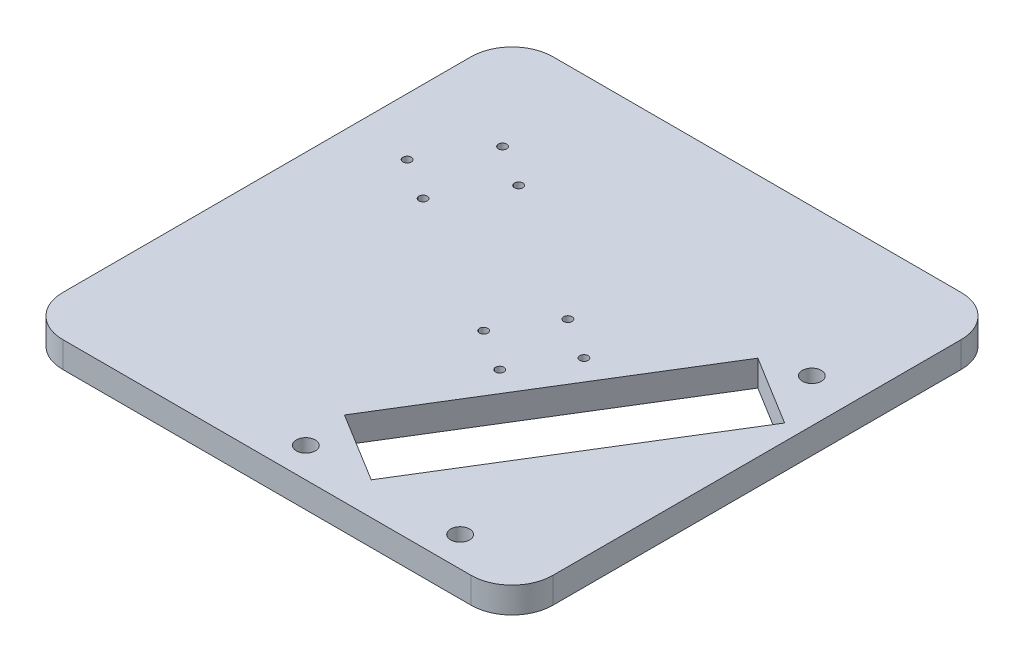
from build123d import *

# Parameters (mm, degrees)
BOSS_EXTRUDE1_DEPTH = 6.35
SKETCH2_R           = 2.325
CUT_EXTRUDE1_DEPTH  = 170.824387236
SKETCH5_R           = 1.025
CUT_EXTRUDE2_DEPTH  = 170.824387236


with BuildPart() as part:
    # Sketch1 → Boss-Extrude1 (new body)
    with BuildSketch(Plane(origin=(0, 0, 0), x_dir=(1, 0, 0), z_dir=(0, 1, 0))):
        with BuildLine():
            Line((10, 0), (110, 0))
            ThreePointArc((110, 0), (117.071067812, 2.928932188), (120, 10))
            Line((120, 10), (120, 110))
            ThreePointArc((120, 110), (117.071067812, 117.071067812), (110, 120))
            Line((110, 120), (10, 120))
            ThreePointArc((10, 120), (2.928932188, 117.071067812), (0, 110))
            Line((0, 110), (0, 10))
            ThreePointArc((0, 10), (2.928932188, 2.928932188), (10, 0))
        make_face()
    extrude(amount=BOSS_EXTRUDE1_DEPTH)

    # Sketch2 → Cut-Extrude1 (cut, through all)
    with BuildSketch(Plane(origin=(0, 6.35, 0), x_dir=(1, 0, 0), z_dir=(0, 1, 0))):
        with Locations(Location((62.192235265, 7.325, 0), (0, 0, 270))):
            Circle(SKETCH2_R)
        with Locations(Location((99.974668934, 7.325, 0), (0, 0, 270))):
            Circle(SKETCH2_R)
        with Locations(Location((109.393095317, 84.031927265, 0), (0, 0, 270))):
            Circle(SKETCH2_R)
        Polygon((60.471691743, 18.506055104), (77.505195351, 8.02465468), (116.066267511, 70.690914453), (99.032763904, 81.172314877), align=None)
    extrude(amount=-CUT_EXTRUDE1_DEPTH, mode=Mode.SUBTRACT)

    # Sketch5 → Cut-Extrude2 (cut, through all)
    with BuildSketch(Plane(origin=(0, 6.35, 0), x_dir=(1, 0, 0), z_dir=(0, 1, 0))):
        with Locations(Location((69.859976402, 47.120111286, 0), (0, 0, 270))):
            Circle(SKETCH5_R)
        with Locations(Location((59.639874237, 53.408951541, 0), (0, 0, 270))):
            Circle(SKETCH5_R)
        with Locations(Location((77.72102672, 59.895238992, 0), (0, 0, 270))):
            Circle(SKETCH5_R)
        with Locations(Location((67.500924556, 66.184079246, 0), (0, 0, 270))):
            Circle(SKETCH5_R)
        with Locations(Location((13.977019656, 80.332987484, 0), (0, 0, 270))):
            Circle(SKETCH5_R)
        with Locations(Location((24.197121821, 74.04414723, 0), (0, 0, 270))):
            Circle(SKETCH5_R)
        with Locations(Location((33.106312181, 88.522625296, 0), (0, 0, 270))):
            Circle(SKETCH5_R)
        with Locations(Location((22.886210017, 94.811465551, 0), (0, 0, 270))):
            Circle(SKETCH5_R)
    extrude(amount=-CUT_EXTRUDE2_DEPTH, mode=Mode.SUBTRACT)


solid = part.part
